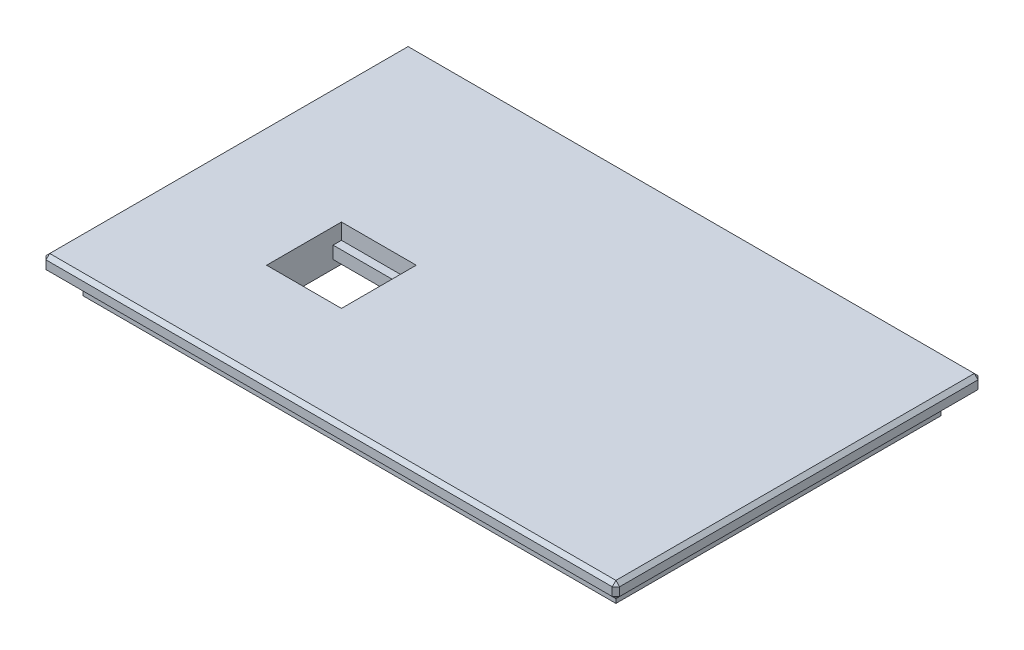
from build123d import *

# Parameters (mm, degrees)
SKETCH1_W           = 138
SKETCH1_H           = 88
BOSS_EXTRUDE1_DEPTH = 3.81
CHAMFER1_SIZE       = 0.889
SKETCH2_W           = 128.222
SKETCH2_H           = 78.222
BOSS_EXTRUDE2_DEPTH = 5
SKETCH3_W           = 18
SKETCH3_H           = 18
CUT_EXTRUDE1_DEPTH  = 10
SKETCH4_W           = 18
SKETCH4_H           = 2
BOSS_EXTRUDE3_DEPTH = 3


with BuildPart() as part:
    # Sketch1 → Boss-Extrude1 (new body)
    with BuildSketch(Plane(origin=(0, 0, 0), x_dir=(1, 0, 0), z_dir=(0, 1, 0))):
        with Locations((32.17, -15.806)):
            Rectangle(SKETCH1_W, SKETCH1_H)
    extrude(amount=-BOSS_EXTRUDE1_DEPTH)

    # Chamfer1
    chamfer1_edges = [part.edges().sort_by_distance(p)[0] for p in [
        (-36.83, -3.81, 15.806),
        (32.17, -3.81, 59.806),
        (101.17, -3.81, 15.806),
        (32.17, 0, 59.806),
        (-36.83, 0, 15.806),
        (32.17, 0, -28.194),
        (101.17, 0, 15.806),
        (32.17, -3.81, -28.194),
        (101.17, -1.905, 59.806),
        (-36.83, -1.905, 59.806),
        (-36.83, -1.905, -28.194),
        (101.17, -1.905, -28.194),
    ]]
    chamfer(chamfer1_edges, length=CHAMFER1_SIZE)


with BuildPart() as body_2:
    # Sketch2 → Boss-Extrude2 (new body)
    with BuildSketch(Plane(origin=(0, -3.81, 0), x_dir=(1, 0, 0), z_dir=(0, 1, 0))):
        with Locations((32.17, -15.806)):
            Rectangle(SKETCH2_W, SKETCH2_H)
    extrude(amount=-BOSS_EXTRUDE2_DEPTH)


with BuildPart() as cut_extrude1_tool:
    # Sketch3 → Cut-Extrude1 (new body)
    with BuildSketch(Plane(origin=(0, 0, 0), x_dir=(-1, 0, 0), z_dir=(0, -1, 0))):
        with Locations((-1.599154352, -26.272344334)):
            Rectangle(SKETCH3_W, SKETCH3_H)
    extrude(amount=CUT_EXTRUDE1_DEPTH)


with BuildPart() as part_1:
    add(part.part)

    # Cut-Extrude1: cut by cut_extrude1_tool
    add(cut_extrude1_tool.part, mode=Mode.SUBTRACT)



with BuildPart() as body_2_1:
    add(body_2.part)

    # Cut-Extrude1: cut by cut_extrude1_tool
    add(cut_extrude1_tool.part, mode=Mode.SUBTRACT)


with BuildPart() as part_2:
    add(part_1.part)

    add(body_2_1.part)  # Boss-Extrude3 merges body 2
    # Sketch4 → Boss-Extrude3 (add)
    with BuildSketch(Plane(origin=(0, -3.81, 0), x_dir=(-1, 0, 0), z_dir=(0, -1, 0))):
        with Locations((-1.599154352, -18.272344334)):
            Rectangle(SKETCH4_W, SKETCH4_H)
        with Locations((-1.599154352, -34.272344334)):
            Rectangle(SKETCH4_W, SKETCH4_H)
    extrude(amount=BOSS_EXTRUDE3_DEPTH)


solid = part_2.part
